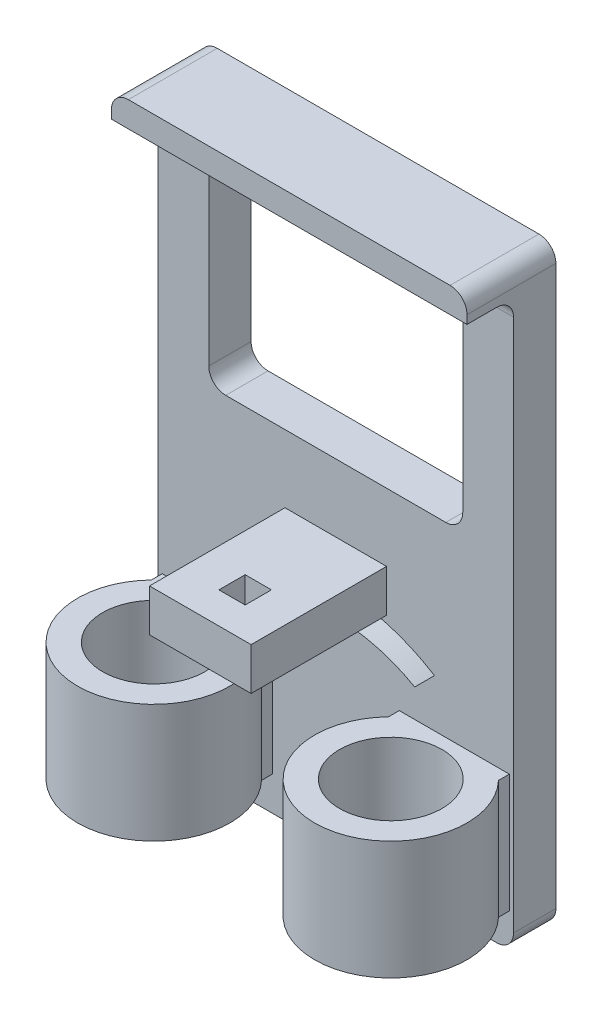
from build123d import *
from build123d.topology import SkipClean

# Parameters (mm, degrees)
SKETCH1_W                                    = 42
SKETCH1_H                                    = 40
BOSS_EXTRUDE2_DEPTH                          = 2
SKETCH2_W                                    = 6
SKETCH2_H                                    = 4
BOSS_EXTRUDE5_DEPTH                          = 3
SKETCH4_R                                    = 3.5
SKETCH4_R_2                                  = 1.6
BOSS_EXTRUDE6_DEPTH                          = 4
MIRROR2_AT_THE_SECOND_PLANE_COPY_1_SKETC_W   = 6
MIRROR2_AT_THE_SECOND_PLANE_COPY_1_SKETC_H   = 4
MIRROR2_AT_THE_SECOND_PLANE_COPY_1_DEPTH     = 3
MIRROR2_AT_THE_SECOND_PLANE_COPY_2_SKETC_R   = 3.5
MIRROR2_AT_THE_SECOND_PLANE_COPY_2_SKETC_R_2 = 1.6
MIRROR2_AT_THE_SECOND_PLANE_COPY_2_DEPTH     = 4
CUT_EXTRUDE2_DEPTH                           = 2
SKETCH8_R                                    = 1.6
CUT_EXTRUDE3_DEPTH                           = 2
SKETCH18_W                                   = 6
SKETCH18_H                                   = 2
BOSS_EXTRUDE10_DEPTH                         = 30
SKETCH19_W                                   = 42
SKETCH19_H                                   = 3.5
BOSS_EXTRUDE11_DEPTH                         = 3
SKETCH20_R                                   = 1.6
BOSS_EXTRUDE12_DEPTH                         = 10
SKETCH22_R                                   = 1.6
CUT_EXTRUDE4_DEPTH                           = 7
SKETCH23_R                                   = 6.05
BOSS_EXTRUDE14_DEPTH                         = 14
SKETCH21_R                                   = 1.6
CUT_EXTRUDE5_DEPTH                           = 10
CUT_EXTRUDE7_DEPTH                           = 22
CUT_EXTRUDE9_DEPTH                           = 2
BOSS_EXTRUDE19_START                         = 2
SKETCH32_R                                   = 3.5
BOSS_EXTRUDE19_DEPTH                         = 2
SKETCH33_W                                   = 42
SKETCH33_H                                   = 3
BOSS_EXTRUDE20_DEPTH                         = 4
SKETCH34_W                                   = 42
SKETCH34_H                                   = 70
SKETCH34_R                                   = 1.6
SKETCH34_W_2                                 = 30
SKETCH34_H_2                                 = 27
BOSS_EXTRUDE21_DEPTH                         = 3
BOSS_EXTRUDE22_DEPTH                         = 14
FILLET1_R                                    = 2
SKETCH36_W                                   = 12
SKETCH36_H                                   = 5
BOSS_EXTRUDE23_DEPTH                         = 16
SKETCH37_W                                   = 3.1
SKETCH37_H                                   = 3.1
CUT_EXTRUDE10_DEPTH                          = 12


with BuildPart() as part:
    # Sketch1 → Boss-Extrude2 (new body)
    with BuildSketch(Plane.XY):
        Rectangle(SKETCH1_W, SKETCH1_H)
    extrude(amount=BOSS_EXTRUDE2_DEPTH)

    # Sketch2 → Boss-Extrude5 (add)
    with BuildSketch(Plane.XY.offset(2)):
        with Locations((-14, 10)):
            Rectangle(SKETCH2_W, SKETCH2_H)
    boss_extrude5 = extrude(amount=BOSS_EXTRUDE5_DEPTH)

    # Sketch4 → Boss-Extrude6 (add)
    with BuildSketch(Plane(origin=(0, 12, 0), x_dir=(1, 0, 0), z_dir=(0, 1, 0))):
        with Locations((-14, -6.6)):
            Circle(SKETCH4_R)
        with Locations(Location((-14, -6.6, 0), (0, 0, 270))):
            Circle(SKETCH4_R_2, mode=Mode.SUBTRACT)
    boss_extrude6 = extrude(amount=-BOSS_EXTRUDE6_DEPTH)

    # Mirror2: Boss-Extrude5, Boss-Extrude6 across plane
    add(boss_extrude5.mirror(Plane(origin=(0, 0, 0), x_dir=(0, 0, 1), z_dir=(1, 0, 0))))
    add(boss_extrude6.mirror(Plane(origin=(0, 0, 0), x_dir=(0, 0, 1), z_dir=(1, 0, 0))))

    # Mirror2 at the second plane: Boss-Extrude5, Boss-Extrude6 across plane
    add(boss_extrude5.mirror(Plane(origin=(0, 3, 0), x_dir=(0, 0, 1), z_dir=(0, -1, 0))))
    add(boss_extrude6.mirror(Plane(origin=(0, 3, 0), x_dir=(0, 0, 1), z_dir=(0, -1, 0))))

    # Mirror2 at the second plane copy 1 sketc → Mirror2 at the second plane copy 1 (add)
    with BuildSketch(Plane(origin=(0, 6, 2), x_dir=(-1, 0, 0), z_dir=(0, 0, 1))):
        with Locations((-14, 10)):
            Rectangle(MIRROR2_AT_THE_SECOND_PLANE_COPY_1_SKETC_W, MIRROR2_AT_THE_SECOND_PLANE_COPY_1_SKETC_H)
    extrude(amount=MIRROR2_AT_THE_SECOND_PLANE_COPY_1_DEPTH)

    # Mirror2 at the second plane copy 2 sketc → Mirror2 at the second plane copy 2 (add)
    with BuildSketch(Plane(origin=(0, -6, 0), x_dir=(-1, 0, 0), z_dir=(0, -1, 0))):
        with Locations((-14, -6.6)):
            Circle(MIRROR2_AT_THE_SECOND_PLANE_COPY_2_SKETC_R)
        with Locations(Location((-14, -6.6, 0), (0, 0, 270))):
            Circle(MIRROR2_AT_THE_SECOND_PLANE_COPY_2_SKETC_R_2, mode=Mode.SUBTRACT)
    extrude(amount=-MIRROR2_AT_THE_SECOND_PLANE_COPY_2_DEPTH)

    # Sketch7 → Cut-Extrude2 (cut)
    with BuildSketch(Plane.XY.offset(2)):
        with BuildLine():
            ThreePointArc((9.324585763, 1.324585763), (0, 3.8), (-9.324585763, 1.324585763))
            Line((-9.324585763, 1.324585763), (-11.657506391, 3.657506391))
            ThreePointArc((-11.657506391, 3.657506391), (0, 7), (11.657506391, 3.657506391))
            Line((11.657506391, 3.657506391), (9.324585763, 1.324585763))
        make_face()
    extrude(amount=-CUT_EXTRUDE2_DEPTH, mode=Mode.SUBTRACT)

    # Sketch8 → Cut-Extrude3 (cut)
    with BuildSketch(Plane(origin=(0, 0, 0), x_dir=(-1, 0, 0), z_dir=(0, 0, -1))):
        with Locations((0, -10)):
            Circle(SKETCH8_R)
    extrude(amount=-CUT_EXTRUDE3_DEPTH, mode=Mode.SUBTRACT)

    # Sketch18 → Boss-Extrude10 (add)
    with BuildSketch(Plane(origin=(0, 20, 0), x_dir=(1, 0, 0), z_dir=(0, 1, 0))):
        with Locations((-18, -1)):
            Rectangle(SKETCH18_W, SKETCH18_H)
        with Locations((18, -1)):
            Rectangle(SKETCH18_W, SKETCH18_H)
    extrude(amount=BOSS_EXTRUDE10_DEPTH)

    # Sketch19 → Boss-Extrude11 (add)
    with BuildSketch(Plane(origin=(0, 50, 0), x_dir=(1, 0, 0), z_dir=(0, 1, 0))):
        with Locations((0, -1.75)):
            Rectangle(SKETCH19_W, SKETCH19_H)
    extrude(amount=-BOSS_EXTRUDE11_DEPTH)

    # Sketch20 → Boss-Extrude12 (add)
    # profile 1 of 2: a face of its own
    with SkipClean():  # the faces are left unmerged after this step: merging them gives an invalid solid
        with BuildSketch(Plane.XZ.offset(6)):
            with BuildLine():
                Line((-11, 2), (-11, 4.797224362))
                ThreePointArc((-11, 4.797224362), (-14, 10.1), (-17, 4.797224362))
                Line((-17, 4.797224362), (-17, 2))
                Line((-17, 2), (-11, 2))
            make_face()
            with Locations(Location((-14, 6.6, 0), (0, 0, 90))):
                Circle(SKETCH20_R, mode=Mode.SUBTRACT)
        # profile 2 of 2: a face of its own
        with BuildSketch(Plane.XZ.offset(6)):
            with BuildLine():
                Line((11, 4.797224362), (11, 2))
                Line((11, 2), (17, 2))
                Line((17, 2), (17, 4.797224362))
                ThreePointArc((17, 4.797224362), (14, 10.1), (11, 4.797224362))
            make_face()
            with Locations(Location((14, 6.6, 0), (0, 0, 90))):
                Circle(SKETCH20_R, mode=Mode.SUBTRACT)
        extrude(amount=BOSS_EXTRUDE12_DEPTH)

    # Sketch22 → Cut-Extrude4 (cut)
    # profile 1 of 2: a face of its own
    with BuildSketch(Plane(origin=(0, -2, 0), x_dir=(1, 0, 0), z_dir=(0, 1, 0))):
        with BuildLine():
            Line((11, -2), (11, -4.797224362))
            ThreePointArc((11, -4.797224362), (14, -10.1), (17, -4.797224362))
            Line((17, -4.797224362), (17, -2))
            Line((17, -2), (11, -2))
        make_face()
        with Locations(Location((14, -6.6, 0), (0, 0, 90))):
            Circle(SKETCH22_R, mode=Mode.SUBTRACT)
    # profile 2 of 2: a face of its own
    with BuildSketch(Plane(origin=(0, -2, 0), x_dir=(1, 0, 0), z_dir=(0, 1, 0))):
        with BuildLine():
            Line((-11, -4.797224362), (-11, -2))
            Line((-11, -2), (-17, -2))
            Line((-17, -2), (-17, -4.797224362))
            ThreePointArc((-17, -4.797224362), (-14, -10.1), (-11, -4.797224362))
        make_face()
        with Locations(Location((-14, -6.6, 0), (0, 0, 90))):
            Circle(SKETCH22_R, mode=Mode.SUBTRACT)
    extrude(amount=-CUT_EXTRUDE4_DEPTH, mode=Mode.SUBTRACT)

    # Sketch23 → Boss-Extrude14 (add)
    # profile 1 of 3: a face of its own
    with BuildSketch(Plane.XZ.offset(16)):
        with BuildLine():
            Line((-19, 2), (-17, 2))
            Line((-17, 2), (-17, 4.246191857))
            ThreePointArc((-17, 4.246191857), (-17.03747428, 14.732231837), (-7.95, 9.5))
            ThreePointArc((-7.95, 9.5), (-8.767768163, 6.46252572), (-11, 4.246191857))
            Line((-11, 4.246191857), (-11, 2))
            Line((-11, 2), (-9, 2))
            Line((-9, 2), (-9, 3.909830056))
            ThreePointArc((-9, 3.909830056), (-14, 17), (-19, 3.909830056))
            Line((-19, 3.909830056), (-19, 2))
        make_face()
    # profile 2 of 3: a face of its own
    with BuildSketch(Plane.XZ.offset(16)):
        with BuildLine():
            Line((-17, 4.246191857), (-17, 2))
            Line((-17, 2), (-11, 2))
            Line((-11, 2), (-11, 4.246191857))
            ThreePointArc((-11, 4.246191857), (-14, 3.45), (-17, 4.246191857))
        make_face()
    # profile 3 of 3: a face of its own
    with BuildSketch(Plane.XZ.offset(16)):
        with BuildLine():
            ThreePointArc((9, 3.909830056), (14, 17), (19, 3.909830056))
            Line((19, 3.909830056), (19, 2))
            Line((19, 2), (9, 2))
            Line((9, 2), (9, 3.909830056))
        make_face()
        with Locations(Location((14, 9.5, 0), (0, 0, 270))):
            Circle(SKETCH23_R, mode=Mode.SUBTRACT)
    extrude(amount=-BOSS_EXTRUDE14_DEPTH)

    # Sketch21 → Cut-Extrude5 (cut)
    # profile 1 of 2: a face of its own
    with BuildSketch(Plane(origin=(0, 12, 0), x_dir=(1, 0, 0), z_dir=(0, 1, 0))):
        with BuildLine():
            Line((11, -2), (11, -4.797224362))
            ThreePointArc((11, -4.797224362), (14, -10.1), (17, -4.797224362))
            Line((17, -4.797224362), (17, -2))
            Line((17, -2), (11, -2))
        make_face()
        with Locations(Location((14, -6.6, 0), (0, 0, 90))):
            Circle(SKETCH21_R, mode=Mode.SUBTRACT)
    # profile 2 of 2: a face of its own
    with BuildSketch(Plane(origin=(0, 12, 0), x_dir=(1, 0, 0), z_dir=(0, 1, 0))):
        with BuildLine():
            Line((-11, -4.797224362), (-11, -2))
            Line((-11, -2), (-17, -2))
            Line((-17, -2), (-17, -4.797224362))
            ThreePointArc((-17, -4.797224362), (-14, -10.1), (-11, -4.797224362))
        make_face()
        with Locations(Location((-14, -6.6, 0), (0, 0, 90))):
            Circle(SKETCH21_R, mode=Mode.SUBTRACT)
    extrude(amount=-CUT_EXTRUDE5_DEPTH, mode=Mode.SUBTRACT)

    # Sketch24 → Cut-Extrude7 (cut)
    with BuildSketch(Plane(origin=(0, -9, 0), x_dir=(1, 0, 0), z_dir=(0, 1, 0))):
        with BuildLine():
            Line((11, -4.246191857), (11, -4.797224362))
            ThreePointArc((11, -4.797224362), (14, -10.1), (17, -4.797224362))
            Line((17, -4.797224362), (17, -4.246191857))
            ThreePointArc((17, -4.246191857), (14, -3.45), (11, -4.246191857))
        make_face()
        with BuildLine():
            Line((-11, -4.797224362), (-11, -4.246191857))
            ThreePointArc((-11, -4.246191857), (-14, -3.45), (-17, -4.246191857))
            Line((-17, -4.246191857), (-17, -4.797224362))
            ThreePointArc((-17, -4.797224362), (-14, -10.1), (-11, -4.797224362))
        make_face()
    extrude(amount=-CUT_EXTRUDE7_DEPTH, mode=Mode.SUBTRACT)

    # Sketch25 → Cut-Extrude9 (cut)
    with BuildSketch(Plane.XZ.offset(16)):
        with BuildLine():
            Line((-19, 2), (-9, 2))
            Line((-9, 2), (-9, 3.909830056))
            ThreePointArc((-9, 3.909830056), (-14, 17), (-19, 3.909830056))
            Line((-19, 3.909830056), (-19, 2))
        make_face()
        with BuildLine():
            Line((9, 3.909830056), (9, 2))
            Line((9, 2), (19, 2))
            Line((19, 2), (19, 3.909830056))
            ThreePointArc((19, 3.909830056), (14, 17), (9, 3.909830056))
        make_face()
    extrude(amount=-CUT_EXTRUDE9_DEPTH, mode=Mode.SUBTRACT)

    # Sketch32 → Boss-Extrude19 (add)
    # profile 1 of 2: a face of its own
    with BuildSketch(Plane.XZ.offset(14).offset(BOSS_EXTRUDE19_START)):
        with BuildLine():
            Line((9, 3.909830056), (9, 2))
            Line((9, 2), (19, 2))
            Line((19, 2), (19, 3.909830056))
            ThreePointArc((19, 3.909830056), (14, 17), (9, 3.909830056))
        make_face()
        with Locations(Location((14, 9.5, 0), (0, 0, 270))):
            Circle(SKETCH32_R, mode=Mode.SUBTRACT)
    # profile 2 of 2: a face of its own
    with BuildSketch(Plane.XZ.offset(14).offset(BOSS_EXTRUDE19_START)):
        with BuildLine():
            Line((-19, 3.909830056), (-19, 2))
            Line((-19, 2), (-9, 2))
            Line((-9, 2), (-9, 3.909830056))
            ThreePointArc((-9, 3.909830056), (-14, 17), (-19, 3.909830056))
        make_face()
        with Locations(Location((-14, 9.5, 0), (0, 0, 270))):
            Circle(SKETCH32_R, mode=Mode.SUBTRACT)
    extrude(amount=-BOSS_EXTRUDE19_DEPTH)

    # Sketch33 → Boss-Extrude20 (add)
    with BuildSketch(Plane.XY.offset(3.5)):
        with Locations((0, 48.5)):
            Rectangle(SKETCH33_W, SKETCH33_H)
    extrude(amount=BOSS_EXTRUDE20_DEPTH)

    # Sketch34 → Boss-Extrude21 (add)
    with BuildSketch(Plane(origin=(0, 0, 0), x_dir=(-1, 0, 0), z_dir=(0, 0, -1))):
        with Locations((0, 15)):
            Rectangle(SKETCH34_W, SKETCH34_H)
        with Locations((0, -10)):
            Circle(SKETCH34_R, mode=Mode.SUBTRACT)
        with BuildLine():
            Line((11.657506391, 3.657506391), (9.324585763, 1.324585763))
            ThreePointArc((9.324585763, 1.324585763), (0, 3.8), (-9.324585763, 1.324585763))
            Line((-9.324585763, 1.324585763), (-11.657506391, 3.657506391))
            ThreePointArc((-11.657506391, 3.657506391), (0, 7), (11.657506391, 3.657506391))
        make_face(mode=Mode.SUBTRACT)
        with Locations((0, 33.5)):
            Rectangle(SKETCH34_W_2, SKETCH34_H_2, mode=Mode.SUBTRACT)
    extrude(amount=BOSS_EXTRUDE21_DEPTH)

    # Sketch35 → Boss-Extrude22 (add)
    # profile 1 of 2: a face of its own
    with BuildSketch(Plane.XZ.offset(16)):
        with BuildLine():
            Line((-20.5, 3.275050201), (-20.5, 0.5))
            Line((-20.5, 0.5), (-7.5, 0.5))
            Line((-7.5, 0.5), (-7.5, 3.275050201))
            ThreePointArc((-7.5, 3.275050201), (-14, 18.5), (-20.5, 3.275050201))
        make_face()
        with BuildLine():
            Line((-19, 3.909830056), (-19, 2))
            Line((-19, 2), (-9, 2))
            Line((-9, 2), (-9, 3.909830056))
            ThreePointArc((-9, 3.909830056), (-14, 17), (-19, 3.909830056))
        make_face(mode=Mode.SUBTRACT)
    # profile 2 of 2: a face of its own
    with BuildSketch(Plane.XZ.offset(16)):
        with BuildLine():
            Line((7.5, 3.275050201), (7.5, 0.5))
            Line((7.5, 0.5), (20.5, 0.5))
            Line((20.5, 0.5), (20.5, 3.275050201))
            ThreePointArc((20.5, 3.275050201), (14, 18.5), (7.5, 3.275050201))
        make_face()
        with BuildLine():
            Line((9, 3.909830056), (9, 2))
            Line((9, 2), (19, 2))
            Line((19, 2), (19, 3.909830056))
            ThreePointArc((19, 3.909830056), (14, 17), (9, 3.909830056))
        make_face(mode=Mode.SUBTRACT)
    extrude(amount=-BOSS_EXTRUDE22_DEPTH)

    # Fillet1
    fillet1_edges = [part.edges().sort_by_distance(p)[0] for p in [
        (21, 50, 2.25),
        (15, 20, -0.5),
        (-21, 50, 2.25),
        (-15, 20, -0.5),
        (-15, 47, -0.5),
        (18, 47, 2),
        (15, 47, -0.5),
        (-18, 47, 2),
        (21, -20, -0.5),
        (-21, -20, -0.5),
    ]]
    fillet(fillet1_edges, radius=FILLET1_R)

    # Sketch36 → Boss-Extrude23 (add)
    with BuildSketch(Plane.XY.offset(2)):
        with Locations((0, 9.5)):
            Rectangle(SKETCH36_W, SKETCH36_H)
    extrude(amount=BOSS_EXTRUDE23_DEPTH)

    # Sketch37 → Cut-Extrude10 (cut)
    with BuildSketch(Plane(origin=(0, 12, 0), x_dir=(1, 0, 0), z_dir=(0, 1, 0))):
        with Locations((0.05, -12.75)):
            Rectangle(SKETCH37_W, SKETCH37_H)
    extrude(amount=-CUT_EXTRUDE10_DEPTH, mode=Mode.SUBTRACT)


solid = part.part
